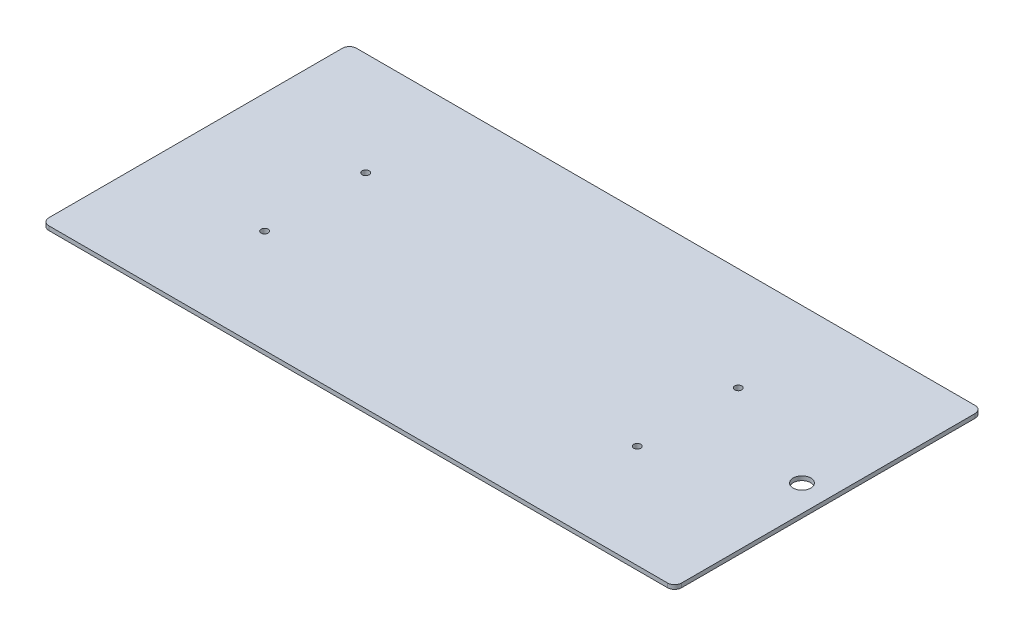
from build123d import *

# Parameters (mm, degrees)
SKETCH1_R               = 2.54
SKETCH1_R_2             = 6.35
MAINBASEPLATE_DEPTH     = 3
BASEBOSS_EXTRUDE2_START = 10.16
SKETCH2_R               = 6.096
SKETCH2_R_2             = 2.54
BASEBOSS_EXTRUDE2_DEPTH = 10.16


with BuildPart() as part:
    # Sketch1 → mainbaseplate (new body)
    with BuildSketch(Plane(origin=(0, 0, 0), x_dir=(1, 0, 0), z_dir=(0, 1, 0))):
        with BuildLine():
            Line((-223.52, -111.125), (223.52, -111.125))
            ThreePointArc((223.52, -111.125), (227.112102448, -109.637102448), (228.6, -106.045))
            Line((228.6, -106.045), (228.6, 106.045))
            ThreePointArc((228.6, 106.045), (227.112102448, 109.637102448), (223.52, 111.125))
            Line((223.52, 111.125), (-223.52, 111.125))
            ThreePointArc((-223.52, 111.125), (-227.112102448, 109.637102448), (-228.6, 106.045))
            Line((-228.6, 106.045), (-228.6, -106.045))
            ThreePointArc((-228.6, -106.045), (-227.112102448, -109.637102448), (-223.52, -111.125))
        make_face()
        with Locations((127, 36.5125)):
            Circle(SKETCH1_R, mode=Mode.SUBTRACT)
        with Locations((127, -36.5125)):
            Circle(SKETCH1_R, mode=Mode.SUBTRACT)
        with Locations((-142.24, 36.5125)):
            Circle(SKETCH1_R, mode=Mode.SUBTRACT)
        with Locations((-142.24, -36.5125)):
            Circle(SKETCH1_R, mode=Mode.SUBTRACT)
        with Locations((209.55, 0)):
            Circle(SKETCH1_R_2, mode=Mode.SUBTRACT)
    extrude(amount=MAINBASEPLATE_DEPTH)

    # Sketch2 → BaseBoss-Extrude2 (add)
    # profile 1 of 4: a face of its own
    with BuildSketch(Plane.XZ.offset(BASEBOSS_EXTRUDE2_START)):
        with Locations((127, 36.5125)):
            Circle(SKETCH2_R)
        with Locations((127, 36.5125)):
            Circle(SKETCH2_R_2, mode=Mode.SUBTRACT)
    # profile 2 of 4: a face of its own
    with BuildSketch(Plane.XZ.offset(BASEBOSS_EXTRUDE2_START)):
        with Locations((127, -36.5125)):
            Circle(SKETCH2_R)
        with Locations((127, -36.5125)):
            Circle(SKETCH2_R_2, mode=Mode.SUBTRACT)
    # profile 3 of 4: a face of its own
    with BuildSketch(Plane.XZ.offset(BASEBOSS_EXTRUDE2_START)):
        with Locations((-142.24, -36.5125)):
            Circle(SKETCH2_R)
        with Locations((-142.24, -36.5125)):
            Circle(SKETCH2_R_2, mode=Mode.SUBTRACT)
    # profile 4 of 4: a face of its own
    with BuildSketch(Plane.XZ.offset(BASEBOSS_EXTRUDE2_START)):
        with Locations((-142.24, 36.5125)):
            Circle(SKETCH2_R)
        with Locations((-142.24, 36.5125)):
            Circle(SKETCH2_R_2, mode=Mode.SUBTRACT)
    extrude(amount=-BASEBOSS_EXTRUDE2_DEPTH)


solid = part.part
